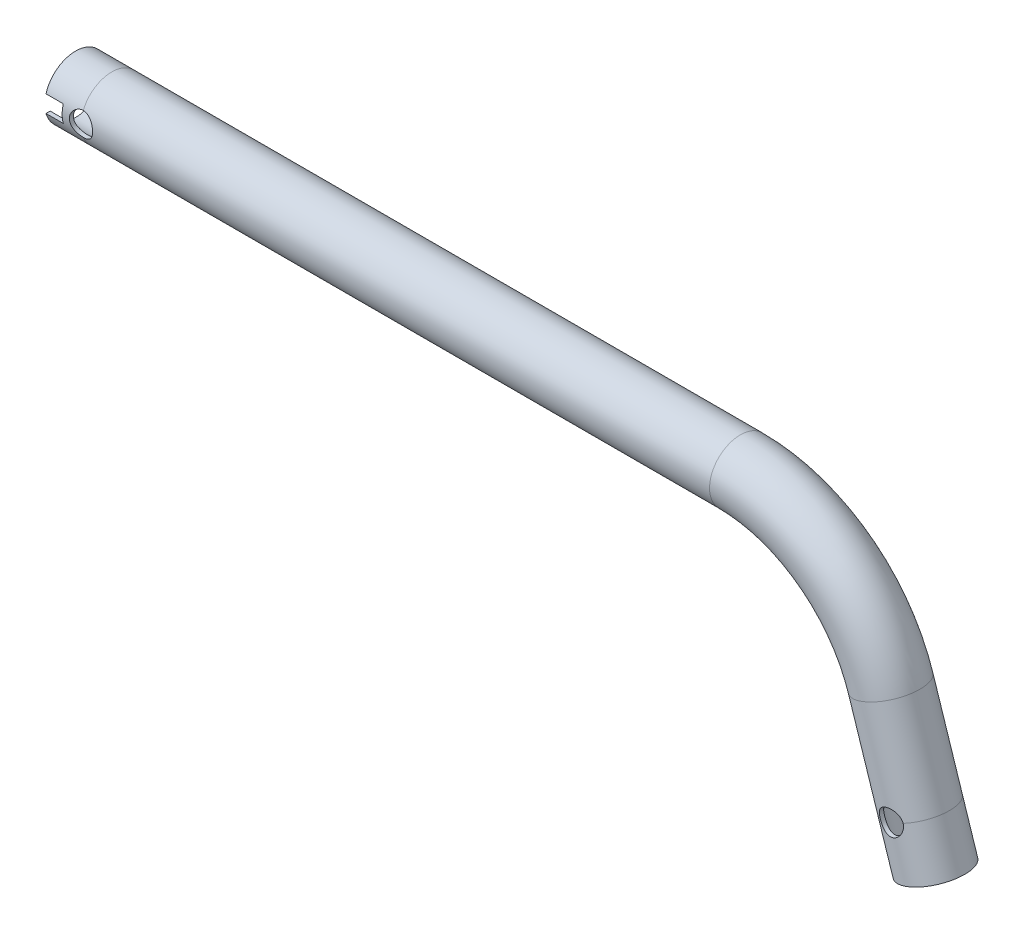
from build123d import *

# Parameters (mm, degrees)
SKETCH2_R                      = 9.25
SKETCH2_R_2                    = 8.05
CUT_EXTRUDE1_REACH             = 269.815
SKETCH3_R                      = 3.6
CUT_EXTRUDE1_DIRECTION_2_REACH = 269.815
CUT_EXTRUDE2_REACH             = 269.815
CUT_EXTRUDE2_END_RADIUS        = 9.25
SKETCH4_R                      = 3.5
CUT_EXTRUDE3_DEPTH             = 268.814672806
CUT_EXTRUDE3_DEPTH_BACK        = 268.814672806


with BuildPart() as part:
    # Sweep1: sweep along a path in Sketch1
    with BuildLine(Plane.XY) as sweep1_path:
        Line((-10.868728062, 0), (0, 0))
        Line((0, 0), (188.864048146, 0))
        ThreePointArc((188.864048146, 0), (216.78384763, -9.071692767), (234.03923267, -32.821692767))
        Line((234.03923267, -32.821692767), (242.87, -60))
        Line((242.87, -60), (247.505254916, -74.265847744))
    # Sketch2 → Sweep1 (sweep)
    with BuildSketch(Plane.ZY.offset(10.868728062)):
        Circle(SKETCH2_R)
        Circle(SKETCH2_R_2, mode=Mode.SUBTRACT)
    sweep(path=sweep1_path.line)

    # Sketch3 → Cut-Extrude1 (cut, up to next)
    with BuildSketch(Plane.XY, mode=Mode.PRIVATE) as cut_extrude1_sk1:
        with Locations(Location((242.87, -60, 0), (0, 0, 18))):
            Circle(SKETCH3_R)
    cut_extrude1_tool1 = extrude(cut_extrude1_sk1.sketch, amount=-CUT_EXTRUDE1_REACH, mode=Mode.PRIVATE) & part.part
    add(cut_extrude1_tool1.solids().sort_by_distance((242.87, -60, 0))[0], mode=Mode.SUBTRACT)

    # Sketch3 → Cut-Extrude1 direction 2 (cut, up to next)
    with BuildSketch(Plane.XY, mode=Mode.PRIVATE) as cut_extrude1_direction_2_sk1:
        with Locations(Location((242.87, -60, 0), (0, 0, 18))):
            Circle(SKETCH3_R)
    cut_extrude1_direction_2_tool1 = extrude(cut_extrude1_direction_2_sk1.sketch, amount=CUT_EXTRUDE1_DIRECTION_2_REACH, mode=Mode.PRIVATE) & part.part
    add(cut_extrude1_direction_2_tool1.solids().sort_by_distance((242.87, -60, 0))[0], mode=Mode.SUBTRACT)

    # Cut-Extrude2: up to this cylinder (the profile starts inside it)
    cut_extrude2_end = Plane(origin=(0, 0, 0), z_dir=(-1, 0, 0)) * Cylinder(CUT_EXTRUDE2_END_RADIUS, 559.13, mode=Mode.PRIVATE)
    # Sketch4 → Cut-Extrude2 (cut, up to the surface)
    with BuildSketch(Plane.XY, mode=Mode.PRIVATE) as cut_extrude2_sk1:
        with Locations(Location((0, 0, 0), (0, 0, 90))):
            Circle(SKETCH4_R)
    cut_extrude2_tool1 = extrude(cut_extrude2_sk1.sketch, amount=CUT_EXTRUDE2_REACH, mode=Mode.PRIVATE) & cut_extrude2_end
    add(cut_extrude2_tool1.solids().sort_by_distance((0, 0, 0))[0], mode=Mode.SUBTRACT)

    # Sketch5 → Cut-Extrude3 (cut, two sides: drawn at the far end of the back side and taken through both)
    with BuildSketch(Plane.XY.offset(-CUT_EXTRUDE3_DEPTH_BACK)):
        Polygon((-10.868728062, 0), (-10.868728062, 2.555), (-5.668728062, 2.555), (-5.668728062, -2.555), (-10.868728062, -2.555), align=None)
    extrude(amount=CUT_EXTRUDE3_DEPTH + CUT_EXTRUDE3_DEPTH_BACK, mode=Mode.SUBTRACT)


solid = part.part
